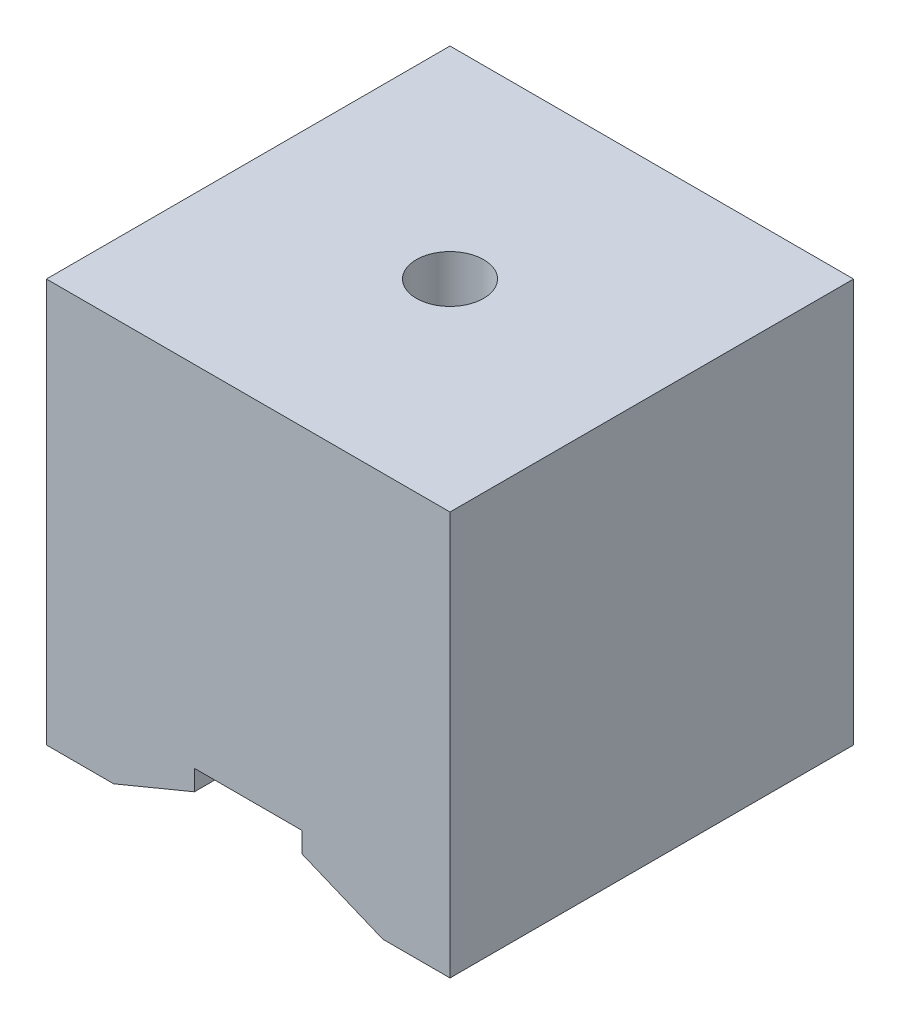
from build123d import *

# Parameters (mm, degrees)
SKETCH_1_W             = 30
SKETCH_1_H             = 30
EXTRUDE_1_DEPTH        = 30
CUT_EXTRUDE_1_DEPTH    = 52.961524227
HOLE_WIZARD_M6_1_D     = 5
HOLE_WIZARD_M6_1_DEPTH = 15
HOLE_WIZARD_M6_1_TIP   = 1.502151548


with BuildPart() as part:
    # 草图1 → 凸台-拉伸1 (new body)
    with BuildSketch(Plane.XY):
        with Locations((15, 15)):
            Rectangle(SKETCH_1_W, SKETCH_1_H)
    extrude(amount=EXTRUDE_1_DEPTH)

    # 草图2 → 切除-拉伸1 (cut, through all)
    with BuildSketch(Plane.XY.offset(30)):
        Polygon((5, 0), (11, 2.485281374), (11, 4), (19, 4), (19, 2.485281374), (25, 0), align=None)
    extrude(amount=-CUT_EXTRUDE_1_DEPTH, mode=Mode.SUBTRACT)

    # M6 螺纹孔1
    with Locations(Plane(origin=(0, 30, 0), x_dir=(1, 0, 0), z_dir=(0, 1, 0))):
        with Locations((15, -15)):
            Hole(HOLE_WIZARD_M6_1_D / 2, depth=HOLE_WIZARD_M6_1_DEPTH)
            with Locations((0, 0, -(HOLE_WIZARD_M6_1_DEPTH + HOLE_WIZARD_M6_1_TIP / 2))):  # 118° drill point
                Cone(0, HOLE_WIZARD_M6_1_D / 2, HOLE_WIZARD_M6_1_TIP, mode=Mode.SUBTRACT)


solid = part.part
